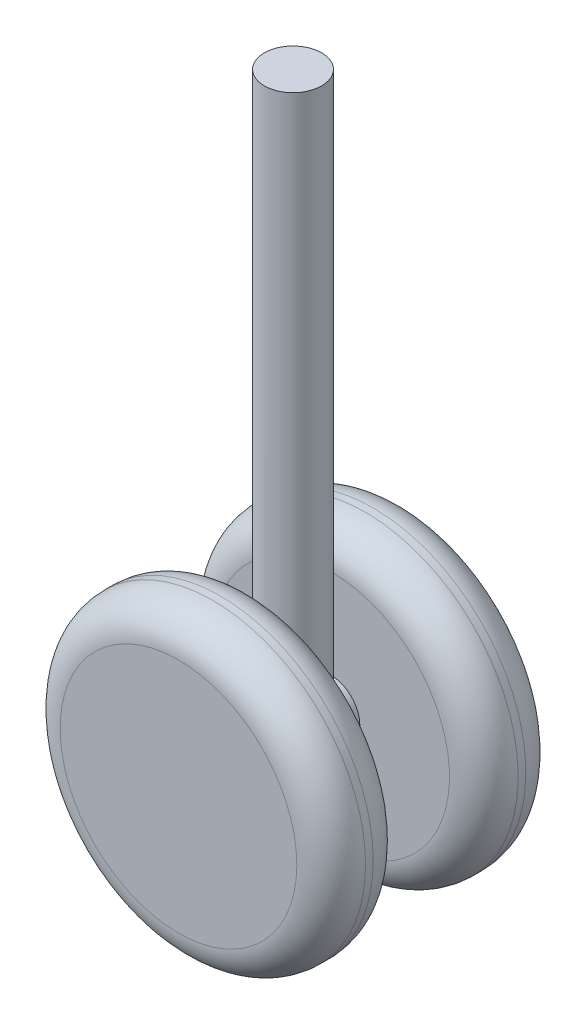
from build123d import *

# Parameters (mm, degrees)
ESBO_O1_R                     = 75
RESSALTO_EXTRUS_O1_DEPTH      = 1500
RESSALTO_EXTRUS_O2_DEPTH      = 200
RESSALTO_EXTRUS_O2_DEPTH_BACK = 200
ESBO_O2_R                     = 75
ESBO_O3_R                     = 400
RESSALTO_EXTRUS_O3_DEPTH      = 100
FILETE1_R                     = 90
FILETE1_OF_ESPELHAR1_R        = 90


with BuildPart() as part:
    # Esboço1 → Ressalto-extrusão1 (new body)
    with BuildSketch(Plane(origin=(0, 0, 0), x_dir=(1, 0, 0), z_dir=(0, 1, 0))):
        Circle(ESBO_O1_R)
    extrude(amount=RESSALTO_EXTRUS_O1_DEPTH)

    # Esboço2 → Ressalto-extrusão2 (add, two sides: drawn at the far end of the back side and taken through both)
    with BuildSketch(Plane.XY.offset(-RESSALTO_EXTRUS_O2_DEPTH_BACK)):
        Circle(ESBO_O2_R)
    extrude(amount=RESSALTO_EXTRUS_O2_DEPTH + RESSALTO_EXTRUS_O2_DEPTH_BACK)

    # Esboço3 → Ressalto-extrusão3 (add, symmetric)
    with BuildSketch(Plane.XY.offset(200)):
        Circle(ESBO_O3_R)
    ressalto_extrus_o3 = extrude(amount=RESSALTO_EXTRUS_O3_DEPTH, both=True)

    # Filete1
    filete1_edges = [part.edges().sort_by_distance(p)[0] for p in [
        (-400, 0, 300),
        (-400, 0, 100),
    ]]
    fillet(filete1_edges, radius=FILETE1_R)

    # Espelhar1: Ressalto-extrusão3 across plane
    add(ressalto_extrus_o3.mirror(Plane.XY))

    # Filete1 of Espelhar1
    filete1_of_espelhar1_edges = [part.edges().sort_by_distance(p)[0] for p in [
        (-400, 0, -300),
        (-400, 0, -100),
    ]]
    fillet(filete1_of_espelhar1_edges, radius=FILETE1_OF_ESPELHAR1_R)


solid = part.part
